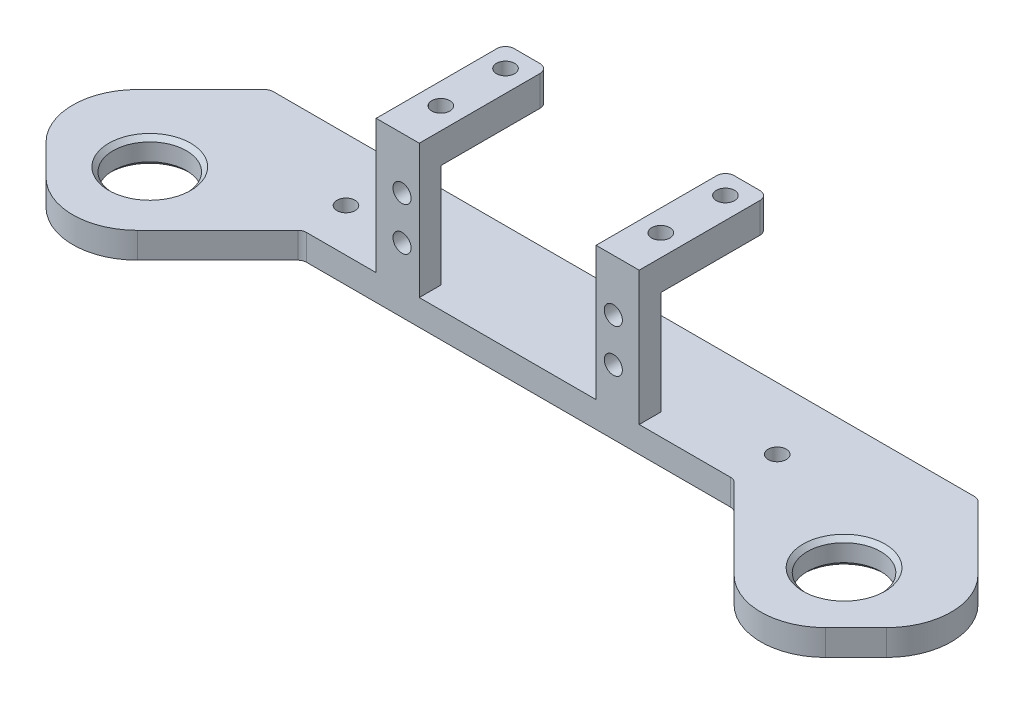
from build123d import *

# Parameters (mm, degrees)
SKETCH_1_R      = 8.5
SKETCH_1_R_2    = 2.1
EXTRUDE_1_DEPTH = 6
FILLET_1_R      = 15
FILLET_2_R      = 2
SKETCH_2_R      = 2.1
EXTRUDE_2_DEPTH = 5
SKETCH_3_W      = 10
SKETCH_3_H      = 30
SKETCH_3_R      = 2.1
EXTRUDE_3_DEPTH = 7
FILLET_4_R      = 2
FILLET_5_R      = 2
CHAMFER_1_SIZE  = 1


with BuildPart() as part:
    # 草图1 → 凸台-拉伸1 (new body)
    with BuildSketch(Plane(origin=(0, 0, 0), x_dir=(1, 0, 0), z_dir=(0, 1, 0))):
        Polygon((0, 0), (100, 0), (129.781745931, -29.781745931), (158.066017178, -1.497474683), (132.13708499, 24.431457505), (70, 24.431457505), (30, 24.431457505), (-32.13708499, 24.431457505), (-58.066017178, -1.497474683), (-29.781745931, -29.781745931), align=None)
        with Locations(Location((-30.5, -5, 0), (0, 0, 270))):
            Circle(SKETCH_1_R, mode=Mode.SUBTRACT)
        with Locations(Location((130.5, -5, 0), (0, 0, 270))):
            Circle(SKETCH_1_R, mode=Mode.SUBTRACT)
        with Locations(Location((0, 10, 0), (0, 0, 270))):
            Circle(SKETCH_1_R_2, mode=Mode.SUBTRACT)
        with Locations(Location((100, 10, 0), (0, 0, 270))):
            Circle(SKETCH_1_R_2, mode=Mode.SUBTRACT)
    extrude(amount=EXTRUDE_1_DEPTH)

    # 圆角1
    fillet_1_edges = [part.edges().sort_by_distance(p)[0] for p in [
        (-29.781745931, 3, 29.781745931),
        (-58.066017178, 3, 1.497474683),
        (158.066017178, 3, 1.497474683),
        (129.781745931, 3, 29.781745931),
    ]]
    fillet(fillet_1_edges, radius=FILLET_1_R)

    # 圆角2
    fillet_2_edges = [part.edges().sort_by_distance(p)[0] for p in [
        (100, 3, 0),
        (0, 3, 0),
    ]]
    fillet(fillet_2_edges, radius=FILLET_2_R)

    # 草图2 → 凸台-拉伸2 (add)
    # profile 1 of 4: a face of its own
    with BuildSketch(Plane.XY):
        Polygon((17, 6), (23, 6), (27, 6), (27, 30), (17, 30), align=None)
        with Locations((23, 15)):
            Circle(SKETCH_2_R, mode=Mode.SUBTRACT)
        with Locations((23, 25)):
            Circle(SKETCH_2_R, mode=Mode.SUBTRACT)
    # profile 2 of 4: a face of its own
    with BuildSketch(Plane.XY):
        Polygon((27, 6), (23, 6), (17, 6), (17, 0), (27, 0), align=None)
    # profile 3 of 4: a face of its own
    with BuildSketch(Plane.XY):
        Polygon((68, 30), (68, 6), (72, 6), (78, 6), (78, 30), align=None)
        with Locations((72, 15)):
            Circle(SKETCH_2_R, mode=Mode.SUBTRACT)
        with Locations((72, 25)):
            Circle(SKETCH_2_R, mode=Mode.SUBTRACT)
    # profile 4 of 4: a face of its own
    with BuildSketch(Plane.XY):
        Polygon((72, 6), (68, 6), (68, 0), (78, 0), (78, 6), align=None)
    extrude(amount=-EXTRUDE_2_DEPTH)

    # 草图3 → 凸台-拉伸3 (add)
    # profile 1 of 2: a face of its own
    with BuildSketch(Plane(origin=(0, 30, 0), x_dir=(1, 0, 0), z_dir=(0, 1, 0))):
        with Locations((22, 15)):
            Rectangle(SKETCH_3_W, SKETCH_3_H)
        with Locations(Location((22, 25, 0), (0, 0, 270))):
            Circle(SKETCH_3_R, mode=Mode.SUBTRACT)
        with Locations(Location((22, 10, 0), (0, 0, 270))):
            Circle(SKETCH_3_R, mode=Mode.SUBTRACT)
    # profile 2 of 2: a face of its own
    with BuildSketch(Plane(origin=(0, 30, 0), x_dir=(1, 0, 0), z_dir=(0, 1, 0))):
        with Locations((73, 15)):
            Rectangle(SKETCH_3_W, SKETCH_3_H)
        with Locations(Location((73, 25, 0), (0, 0, 270))):
            Circle(SKETCH_3_R, mode=Mode.SUBTRACT)
        with Locations(Location((73, 10, 0), (0, 0, 270))):
            Circle(SKETCH_3_R, mode=Mode.SUBTRACT)
    extrude(amount=EXTRUDE_3_DEPTH)

    # 圆角4
    fillet_4_edges = [part.edges().sort_by_distance(p)[0] for p in [
        (27, 33.5, -30),
        (17, 33.5, -30),
        (78, 33.5, -30),
        (68, 33.5, -30),
    ]]
    fillet(fillet_4_edges, radius=FILLET_4_R)

    # 圆角5
    fillet_5_edges = [part.edges().sort_by_distance(p)[0] for p in [
        (-32.13708499, 3, -24.431457505),
        (132.13708499, 3, -24.431457505),
    ]]
    fillet(fillet_5_edges, radius=FILLET_5_R)

    # 倒角1
    chamfer_1_edges = [part.edges().sort_by_distance(p)[0] for p in [
        (-30.5, 0, -3.5),
        (-30.5, 6, -3.5),
        (130.5, 0, -3.5),
        (130.5, 6, -3.5),
    ]]
    chamfer(chamfer_1_edges, length=CHAMFER_1_SIZE)


solid = part.part
